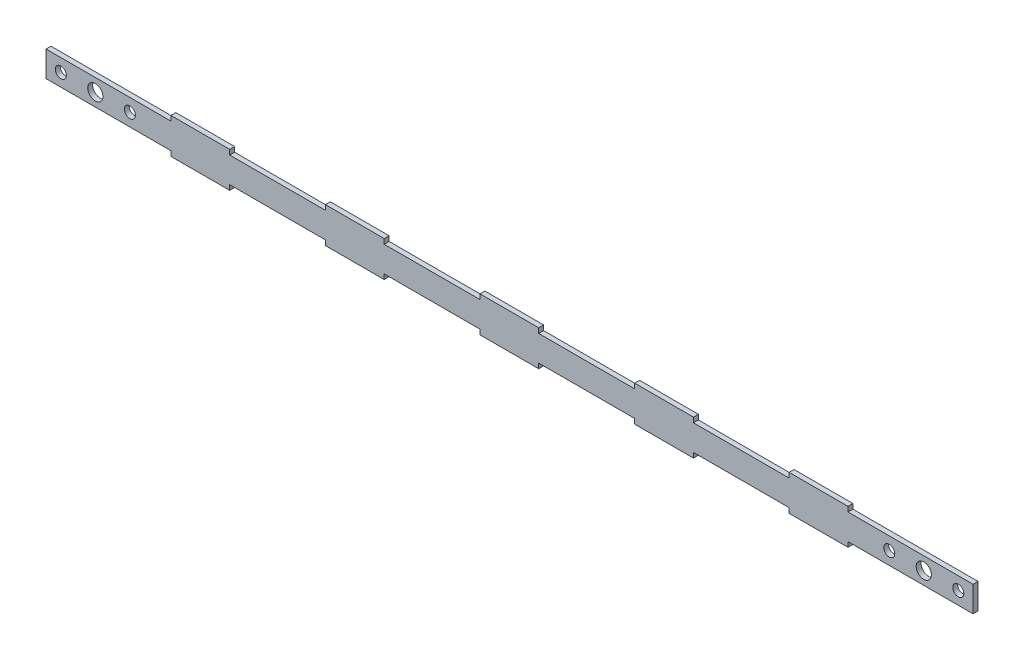
from build123d import *

# Parameters (mm, degrees)
SKETCH1_W           = 596.9
SKETCH1_H           = 16.51
BOSS_EXTRUDE1_DEPTH = 3.175
SKETCH3_W           = 37.846
SKETCH3_H           = 3.175
BOSS_EXTRUDE2_DEPTH = 3.175
SKETCH4_R           = 3.556
SKETCH4_R_2         = 4.8895
CUT_EXTRUDE1_DEPTH  = 299.685667592


with BuildPart() as part:
    # Sketch1 → Boss-Extrude1 (new body)
    with BuildSketch(Plane.XY):
        Rectangle(SKETCH1_W, SKETCH1_H)
    extrude(amount=BOSS_EXTRUDE1_DEPTH)

    # Sketch3 → Boss-Extrude2 (add)
    with BuildSketch(Plane(origin=(0, 8.255, 0), x_dir=(1, 0, 0), z_dir=(0, 1, 0))):
        with Locations((-199.093666667, -1.5875)):
            Rectangle(SKETCH3_W, SKETCH3_H)
        with Locations((-99.610333333, -1.5875)):
            Rectangle(SKETCH3_W, SKETCH3_H)
        with Locations((-0.127, -1.5875)):
            Rectangle(SKETCH3_W, SKETCH3_H)
        with Locations((99.483333333, -1.5875)):
            Rectangle(SKETCH3_W, SKETCH3_H)
        with Locations((198.966666751, -1.5875)):
            Rectangle(SKETCH3_W, SKETCH3_H)
    boss_extrude2 = extrude(amount=BOSS_EXTRUDE2_DEPTH)

    # Mirror1: Boss-Extrude2 across plane
    add(boss_extrude2.mirror(Plane.ZX))

    # Sketch4 → Cut-Extrude1 (cut, through all)
    with BuildSketch(Plane(origin=(0, 0, 0), x_dir=(-1, 0, 0), z_dir=(0, 0, -1))):
        with Locations((-288.925, 0)):
            Circle(SKETCH4_R)
        with Locations((-244.475, 0)):
            Circle(SKETCH4_R)
        with Locations((-266.7, 0)):
            Circle(SKETCH4_R_2)
    cut_extrude1 = extrude(amount=-CUT_EXTRUDE1_DEPTH, mode=Mode.SUBTRACT)

    # Mirror2: Cut-Extrude1 across plane
    add(cut_extrude1.mirror(Plane(origin=(0, 0, 0), x_dir=(0, 0, 1), z_dir=(1, 0, 0))), mode=Mode.SUBTRACT)


solid = part.part
